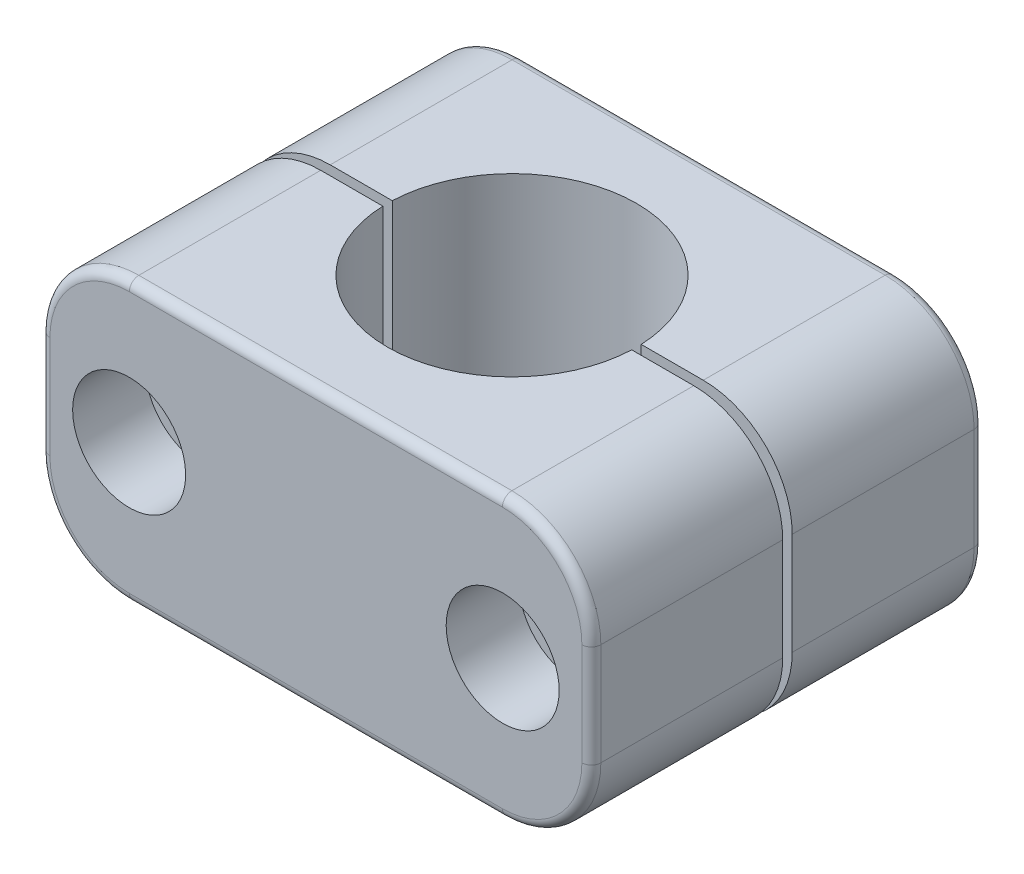
from build123d import *

# Parameters (mm, degrees)
SKETCH1_W          = 59
SKETCH1_H          = 42
SKETCH1_R          = 13.335
EXTRUDE1_DEPTH     = 15
FILLET1_R          = 9.525
FILLET2_R          = 1.016
SKETCH4_W          = 72.5433568
SKETCH4_H          = 1.016
CUT_EXTRUDE3_DEPTH = 50.8


with BuildPart() as part:
    # Sketch1 → Extrude1 (new, symmetric)
    with BuildSketch(Plane(origin=(0, 0, 0), x_dir=(1, 0, 0), z_dir=(0, 1, 0))):
        Rectangle(SKETCH1_W, SKETCH1_H)
        with Locations(Location((0, 0, 0), (0, 0, 270))):
            Circle(SKETCH1_R, mode=Mode.SUBTRACT)
    extrude(amount=EXTRUDE1_DEPTH, both=True)

    # Sketch7 → Cut-Revolve1 (revolve, cut)
    with BuildSketch(Plane(origin=(20, 0, 0), x_dir=(0, 0, -1), z_dir=(1, 0, 0)), mode=Mode.PRIVATE) as cut_revolve1_sk:
        Polygon((-28.8, 0), (28.8, 0), (28.8, 6.05), (13.2, 6.05), (13.2, 3.302), (-13.2, 3.302), (-13.2, 6.05), (-28.8, 6.05), align=None)
    cut_revolve1 = revolve(cut_revolve1_sk.sketch.rotate(Axis((20, 0, -28.8), (0, 0, -1)), 90), axis=Axis((20, 0, -28.8), (0, 0, -1)), mode=Mode.SUBTRACT)

    # Mirror1: Cut-Revolve1 across plane
    add(cut_revolve1.mirror(Plane(origin=(0, 0, 0), x_dir=(0, 0, 1), z_dir=(1, 0, 0))), mode=Mode.SUBTRACT)

    # Fillet1
    fillet1_edges = [part.edges().sort_by_distance(p)[0] for p in [
        (29.5, 15, 0),
        (-29.5, 15, 0),
        (29.5, -15, 0),
        (-29.5, -15, 0),
    ]]
    fillet(fillet1_edges, radius=FILLET1_R)

    # Fillet2
    fillet2_edges = [part.edges().sort_by_distance(p)[0] for p in [
        (-29.5, 0, 21),
        (-29.5, 0, -21),
        (0, -15, 21),
        (29.5, 0, 21),
        (0, 15, 21),
        (26.710192091, 12.210192091, 21),
        (-26.710192091, 12.210192091, 21),
        (26.710192091, -12.210192091, 21),
        (-26.710192091, -12.210192091, 21),
        (0, -15, -21),
        (0, 15, -21),
        (29.5, 0, -21),
        (26.710192091, 12.210192091, -21),
        (-26.710192091, 12.210192091, -21),
        (26.710192091, -12.210192091, -21),
        (-26.710192091, -12.210192091, -21),
    ]]
    fillet(fillet2_edges, radius=FILLET2_R)

    # Sketch4 → Cut-Extrude3 (cut, symmetric)
    with BuildSketch(Plane(origin=(0, 0, 0), x_dir=(-1, 0, 0), z_dir=(0, 1, 0))):
        with Locations((2.534297891, 0)):
            Rectangle(SKETCH4_W, SKETCH4_H)
    extrude(amount=CUT_EXTRUDE3_DEPTH, both=True, mode=Mode.SUBTRACT)


with BuildPart() as cut_extrude3_piece_1:
    # of the separate pieces the step leaves, piece 1, a body of its own (cut_extrude3_pieces)
    add(part.part.solids().sort_by_distance((-28.484, 5.475, 21))[0])


with BuildPart() as cut_extrude3_piece_2:
    # of the separate pieces the step leaves, piece 2, a body of its own (cut_extrude3_pieces)
    add(part.part.solids().sort_by_distance((-29.5, 5.475, -19.984))[0])


solid = Compound([cut_extrude3_piece_1.part, cut_extrude3_piece_2.part])
